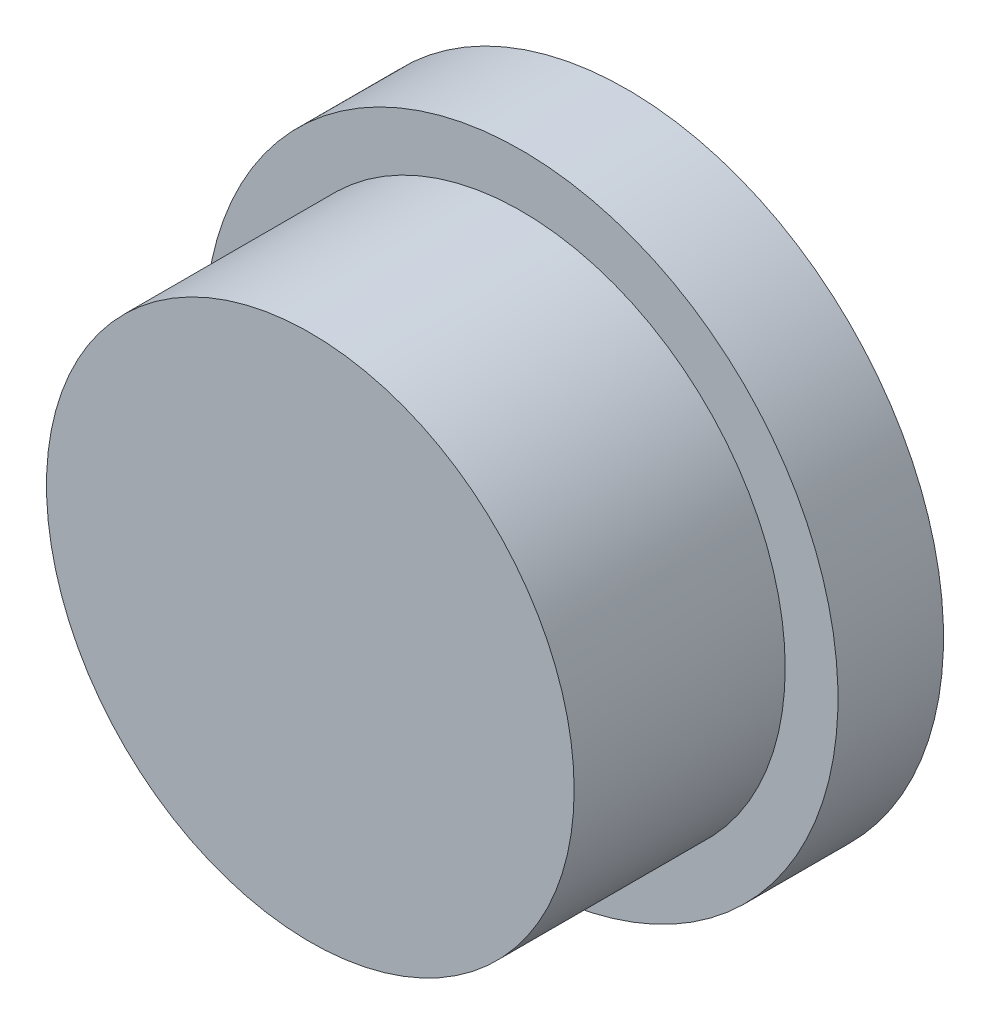
from build123d import *

# Parameters (mm, degrees)
SKETCH_1_R      = 2.5
EXTRUDE_1_DEPTH = 2
SKETCH_2_R      = 3
EXTRUDE_2_DEPTH = 1


with BuildPart() as part:
    # 草图1 → 凸台-拉伸1 (new body)
    with BuildSketch(Plane.XY):
        Circle(SKETCH_1_R)
    extrude(amount=EXTRUDE_1_DEPTH)

    # 草图2 → 凸台-拉伸2 (add)
    with BuildSketch(Plane(origin=(0, 0, 0), x_dir=(-1, 0, 0), z_dir=(0, 0, -1))):
        Circle(SKETCH_2_R)
    extrude(amount=EXTRUDE_2_DEPTH)


solid = part.part
